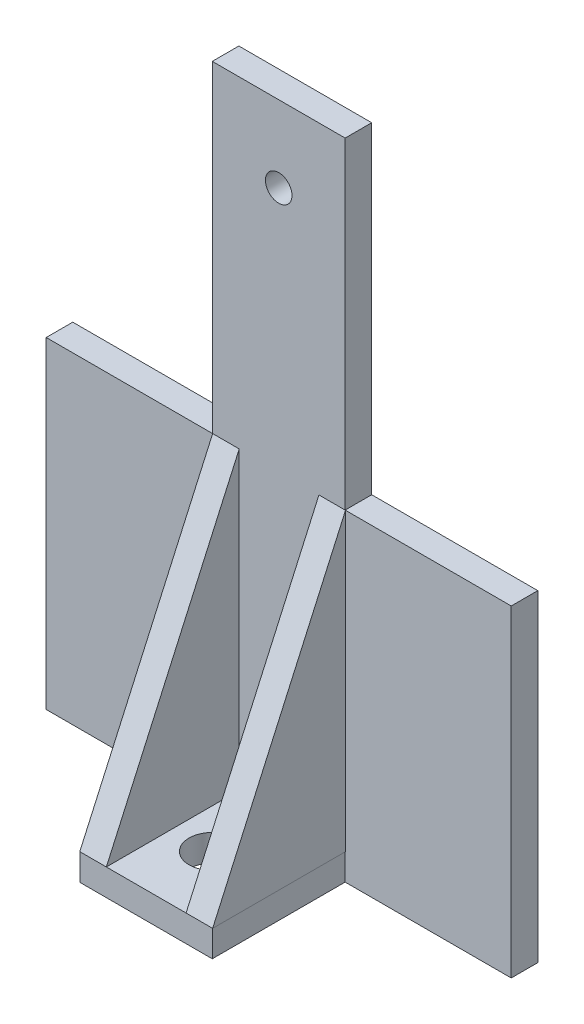
from build123d import *

# Parameters (mm, degrees)
ESBO_O1_R                = 1
RESSALTO_EXTRUS_O1_DEPTH = 2
ESBO_O2_W                = 35
ESBO_O2_H                = 2
RESSALTO_EXTRUS_O2_DEPTH = 10
ESBO_O3_R                = 1.75
CORTE_EXTRUS_O1_DEPTH    = 10
ESBO_O4_W                = 12.527176897
ESBO_O4_H                = 10
ESBO_O4_W_2              = 12.5
CORTE_EXTRUS_O2_DEPTH    = 10
RESSALTO_EXTRUS_O3_DEPTH = 10
ESBO_O6_W                = 6
ESBO_O6_H                = 22.25
CORTE_EXTRUS_O3_DEPTH    = 10


with BuildPart() as part:
    # Esboço1 → Ressalto-extrusão1 (new body)
    with BuildSketch(Plane.XY):
        Polygon((-17.925350174, 14.041666667), (-5.425350174, 14.041666667), (-5.425350174, 38.291666667), (4.574649826, 38.291666667), (4.574649826, 14.041666667), (17.074649826, 14.041666667), (17.074649826, -10.208333333), (-17.925350174, -10.208333333), align=None)
        with Locations((-0.425350174, 32.541666667)):
            Circle(ESBO_O1_R, mode=Mode.SUBTRACT)
        with Locations((-0.425350174, -4.458333333)):
            Circle(ESBO_O1_R, mode=Mode.SUBTRACT)
    extrude(amount=RESSALTO_EXTRUS_O1_DEPTH)

    # Esboço2 → Ressalto-extrusão2 (add)
    with BuildSketch(Plane.XY.offset(2)):
        with Locations((-0.425350174, -9.208333333)):
            Rectangle(ESBO_O2_W, ESBO_O2_H)
    extrude(amount=RESSALTO_EXTRUS_O2_DEPTH)

    # Esboço3 → Corte-extrusão1 (cut)
    with BuildSketch(Plane(origin=(0, -8.208333333, 0), x_dir=(1, 0, 0), z_dir=(0, 1, 0))):
        with Locations(Location((-0.425350174, -7, 0), (0, 0, 270))):
            Circle(ESBO_O3_R)
    extrude(amount=-CORTE_EXTRUS_O1_DEPTH, mode=Mode.SUBTRACT)

    # Esboço4 → Corte-extrusão2 (cut)
    with BuildSketch(Plane(origin=(0, -8.208333333, 0), x_dir=(1, 0, 0), z_dir=(0, 1, 0))):
        with Locations((-11.661761726, -7)):
            Rectangle(ESBO_O4_W, ESBO_O4_H)
        with Locations((10.824649826, -7)):
            Rectangle(ESBO_O4_W_2, ESBO_O4_H)
    extrude(amount=-CORTE_EXTRUS_O2_DEPTH, mode=Mode.SUBTRACT)

    # Esboço5 → Ressalto-extrusão3 (add)
    with BuildSketch(Plane.ZY.offset(5.398173277)):
        Polygon((12, -8.208333333), (2, 14.041666667), (2, -8.208333333), align=None)
    extrude(amount=-RESSALTO_EXTRUS_O3_DEPTH)

    # Esboço6 → Corte-extrusão3 (cut)
    with BuildSketch(Plane.XY.offset(12)):
        with Locations((-0.398173277, 2.916666667)):
            Rectangle(ESBO_O6_W, ESBO_O6_H)
    extrude(amount=-CORTE_EXTRUS_O3_DEPTH, mode=Mode.SUBTRACT)


solid = part.part
